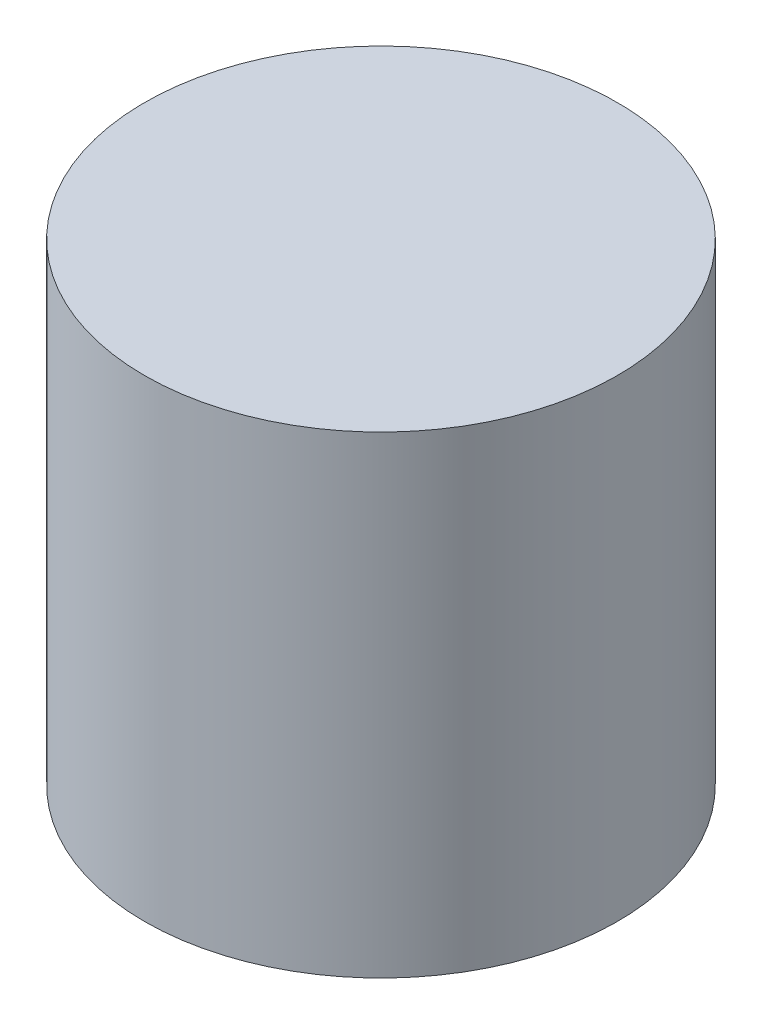
from build123d import *

# Parameters (mm, degrees)
ESQUISSE3_R        = 2
BOSS_EXTRU_1_DEPTH = 4


with BuildPart() as part:
    # Esquisse3 → Boss.-Extru.1 (new body)
    with BuildSketch(Plane(origin=(0, 0, 0), x_dir=(1, 0, 0), z_dir=(0, 1, 0))):
        with Locations(Location((0, 0, 0), (0, 0, 270))):
            Circle(ESQUISSE3_R)
    extrude(amount=BOSS_EXTRU_1_DEPTH)


solid = part.part
